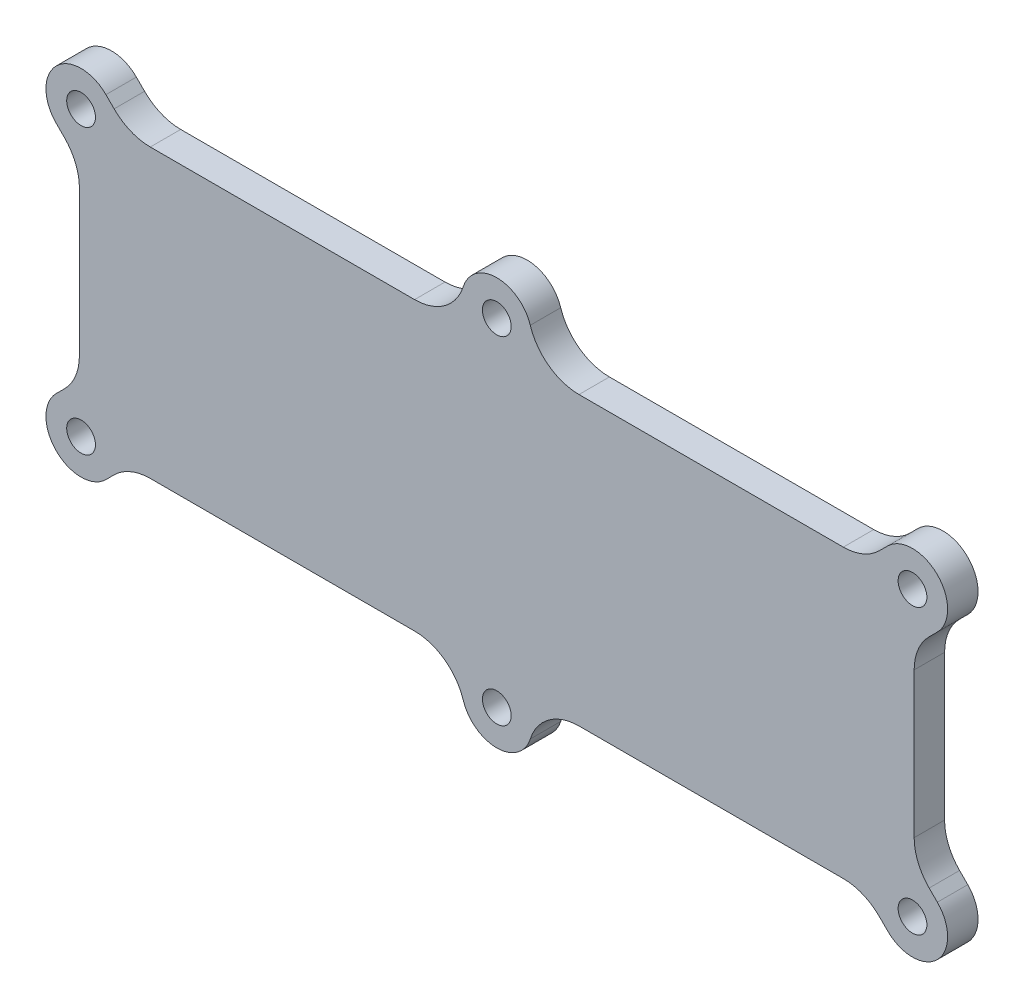
from build123d import *

# Parameters (mm, degrees)
BOSS_EXTRUDE1_DEPTH  = 4.7625
M4_CLEARANCE_HOLE1_D = 4.5


with BuildPart() as part:
    # Sketch1 → Boss-Extrude1 (new body)
    with BuildSketch(Plane.XY):
        with BuildLine():
            Line((61.173729563, 26.089404156), (59.889971157, 24.805645751))
            ThreePointArc((59.889971157, 24.805645751), (57.294584367, 23.07146374), (54.233116908, 22.4625))
            Line((54.233116908, 22.4625), (12.865436095, 22.4625))
            ThreePointArc((12.865436095, 22.4625), (8.142674818, 24.005292715), (5.241473965, 28.038618519))
            ThreePointArc((5.241473965, 28.038618519), (0, 31.8722), (-5.241473965, 28.038618519))
            ThreePointArc((-5.241473965, 28.038618519), (-8.142674818, 24.005292715), (-12.865436095, 22.4625))
            Line((-12.865436095, 22.4625), (-54.233116908, 22.4625))
            ThreePointArc((-54.233116908, 22.4625), (-57.294584367, 23.07146374), (-59.889971157, 24.805645751))
            Line((-59.889971157, 24.805645751), (-61.173729563, 26.089404156))
            ThreePointArc((-61.173729563, 26.089404156), (-68.951904156, 26.089404156), (-68.951904156, 18.311229563))
            Line((-68.951904156, 18.311229563), (-67.668145751, 17.027471157))
            ThreePointArc((-67.668145751, 17.027471157), (-65.93396374, 14.432084367), (-65.325, 11.370616908))
            Line((-65.325, 11.370616908), (-65.325, -11.370616908))
            ThreePointArc((-65.325, -11.370616908), (-65.93396374, -14.432084367), (-67.668145751, -17.027471157))
            Line((-67.668145751, -17.027471157), (-68.951904156, -18.311229563))
            ThreePointArc((-68.951904156, -18.311229563), (-68.951904156, -26.089404156), (-61.173729563, -26.089404156))
            Line((-61.173729563, -26.089404156), (-59.889971157, -24.805645751))
            ThreePointArc((-59.889971157, -24.805645751), (-57.294584367, -23.07146374), (-54.233116908, -22.4625))
            Line((-54.233116908, -22.4625), (-12.865436095, -22.4625))
            ThreePointArc((-12.865436095, -22.4625), (-8.142674818, -24.005292715), (-5.241473965, -28.038618519))
            ThreePointArc((-5.241473965, -28.038618519), (0, -31.8722), (5.241473965, -28.038618519))
            ThreePointArc((5.241473965, -28.038618519), (8.142674818, -24.005292715), (12.865436095, -22.4625))
            Line((12.865436095, -22.4625), (54.233116908, -22.4625))
            ThreePointArc((54.233116908, -22.4625), (57.294584367, -23.07146374), (59.889971157, -24.805645751))
            Line((59.889971157, -24.805645751), (61.173729563, -26.089404156))
            ThreePointArc((61.173729563, -26.089404156), (68.951904156, -26.089404156), (68.951904156, -18.311229563))
            Line((68.951904156, -18.311229563), (67.668145751, -17.027471157))
            ThreePointArc((67.668145751, -17.027471157), (65.93396374, -14.432084367), (65.325, -11.370616908))
            Line((65.325, -11.370616908), (65.325, 11.370616908))
            ThreePointArc((65.325, 11.370616908), (65.93396374, 14.432084367), (67.668145751, 17.027471157))
            Line((67.668145751, 17.027471157), (68.951904156, 18.311229563))
            ThreePointArc((68.951904156, 18.311229563), (68.951904156, 26.089404156), (61.173729563, 26.089404156))
        make_face()
    extrude(amount=BOSS_EXTRUDE1_DEPTH)

    # M4 Clearance Hole1 (through all)
    with Locations(Plane.XY.offset(4.7625)):
        with Locations((-65.062816859, 22.200316859), (0, 26.3722), (65.062816859, 22.200316859), (65.062816859, -22.200316859), (0, -26.3722), (-65.062816859, -22.200316859)):
            Hole(M4_CLEARANCE_HOLE1_D / 2)


solid = part.part
